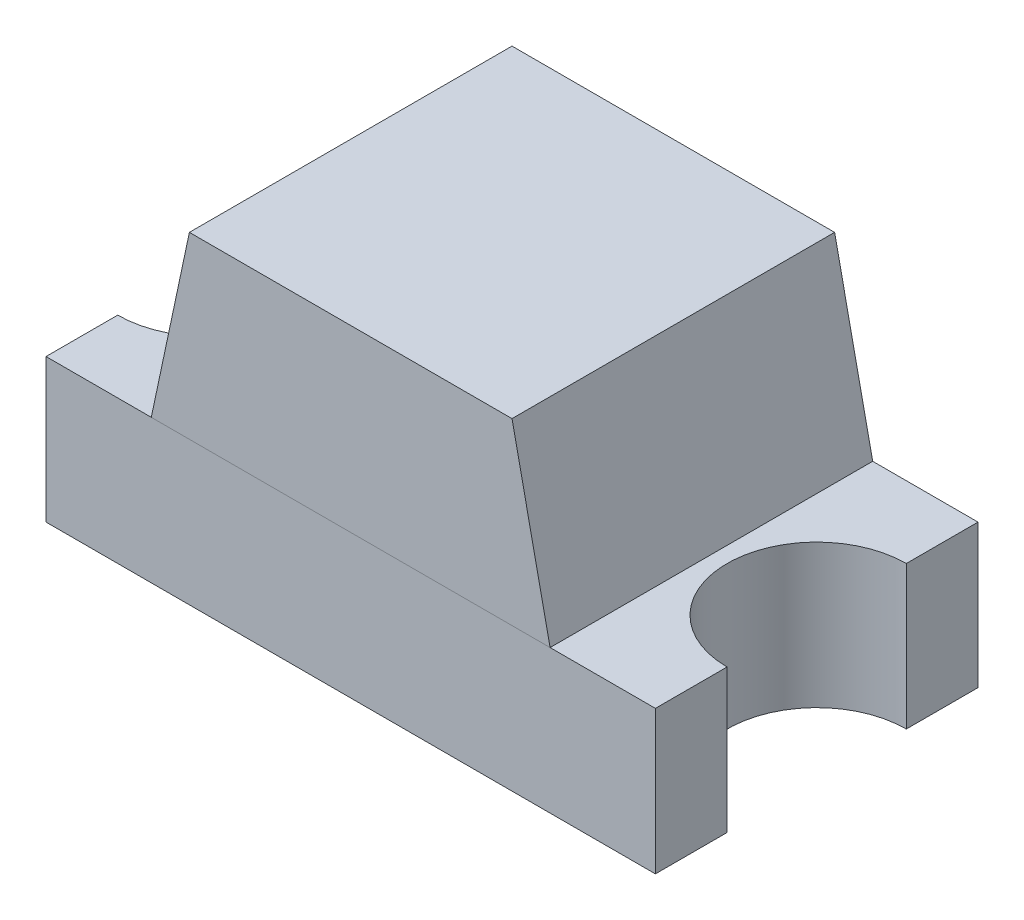
from build123d import *

# Parameters (mm, degrees)
BOSS_EXTRUDE1_DEPTH = 0.4
SKETCH2_W           = 0.9
SKETCH2_H           = 0.9
BOSS_EXTRUDE2_DEPTH = 0.5
DRAFT2_ANGLE        = 12


with BuildPart() as part:
    # Sketch1 → Boss-Extrude1 (new body)
    with BuildSketch(Plane(origin=(0, 0, 0), x_dir=(1, 0, 0), z_dir=(0, 1, 0))):
        with BuildLine():
            Line((-0.85, -0.45), (0.85, -0.45))
            Line((0.85, -0.45), (0.85, -0.25))
            ThreePointArc((0.85, -0.25), (0.6, 0), (0.85, 0.25))
            Line((0.85, 0.25), (0.85, 0.45))
            Line((0.85, 0.45), (-0.85, 0.45))
            Line((-0.85, 0.45), (-0.85, 0.25))
            ThreePointArc((-0.85, 0.25), (-0.6, 0), (-0.85, -0.25))
            Line((-0.85, -0.25), (-0.85, -0.45))
        make_face()
    extrude(amount=BOSS_EXTRUDE1_DEPTH)


with BuildPart() as body_2:
    # Sketch2 → Boss-Extrude2 (new body)
    with BuildSketch(Plane(origin=(0, 0.4, 0), x_dir=(1, 0, 0), z_dir=(0, 1, 0))):
        Rectangle(SKETCH2_W, SKETCH2_H)
    extrude(amount=BOSS_EXTRUDE2_DEPTH)

    # Draft2
    draft2_faces = [body_2.faces().sort_by_distance(p)[0] for p in [
        (-0.45, 0.65, 0),
        (0.45, 0.65, 0),
    ]]
    draft(draft2_faces, Plane(origin=(-0.45, 0.9, -0.45), x_dir=(0, 0, 1), z_dir=(0, 1, 0)), DRAFT2_ANGLE)


solid = Compound([part.part, body_2.part])
